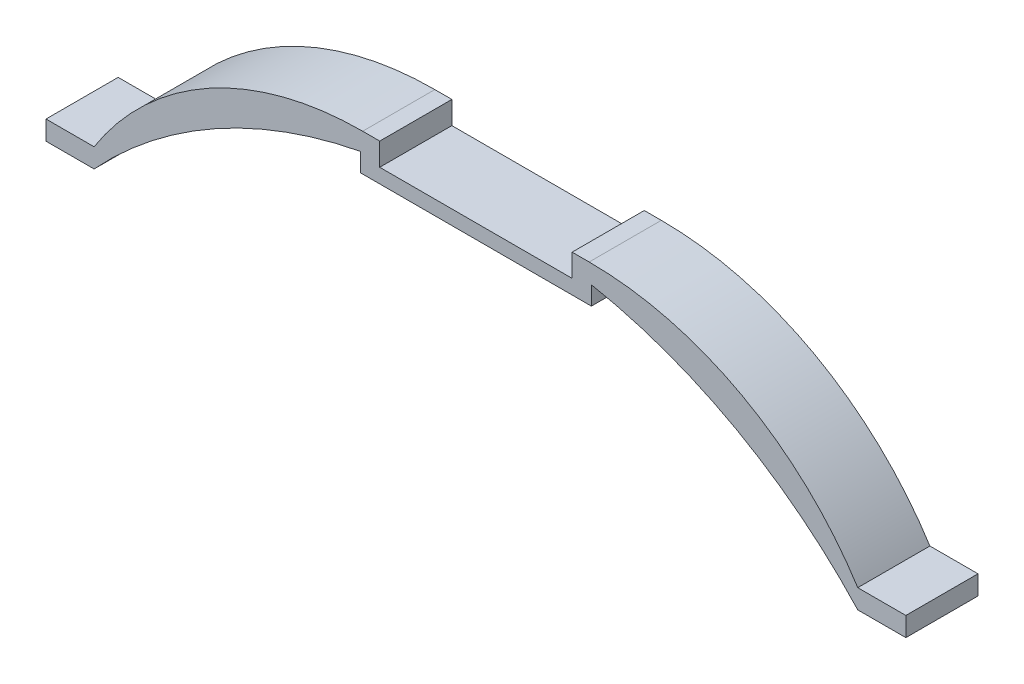
from build123d import *

# Parameters (mm, degrees)
EXTRUDE_2_DEPTH = 15


with BuildPart() as part:
    # 草圖1 → 填料-伸長2 (new body)
    with BuildSketch(Plane.XY):
        with BuildLine():
            Line((20, -0.85915493), (20, 3.860018002))
            Line((20, 3.860018002), (23.543805166, 3.860018002))
            ThreePointArc((23.543805166, 3.860018002), (55.409150332, -4.326684577), (79.382262386, -26.85915493))
            Line((79.382262386, -26.85915493), (89.382262386, -26.85915493))
            Line((89.382262386, -26.85915493), (89.382262386, -30.85915493))
            Line((89.382262386, -30.85915493), (79.382262386, -30.85915493))
            ThreePointArc((79.382262386, -30.85915493), (54.166103207, -10.987798363), (24, 0))
            Line((24, 0), (24, -3.85915493))
            Line((24, -3.85915493), (-24, -3.85915493))
            Line((-24, -3.85915493), (-24, 0))
            ThreePointArc((-24, 0), (-54.166103207, -10.987798363), (-79.382262386, -30.85915493))
            Line((-79.382262386, -30.85915493), (-89.382262386, -30.85915493))
            Line((-89.382262386, -30.85915493), (-89.382262386, -26.85915493))
            Line((-89.382262386, -26.85915493), (-79.382262386, -26.85915493))
            ThreePointArc((-79.382262386, -26.85915493), (-55.409150332, -4.326684577), (-23.543805166, 3.860018002))
            Line((-23.543805166, 3.860018002), (-20, 3.860018002))
            Line((-20, 3.860018002), (-20, -0.85915493))
            Line((-20, -0.85915493), (20, -0.85915493))
        make_face()
    extrude(amount=EXTRUDE_2_DEPTH)


solid = part.part
